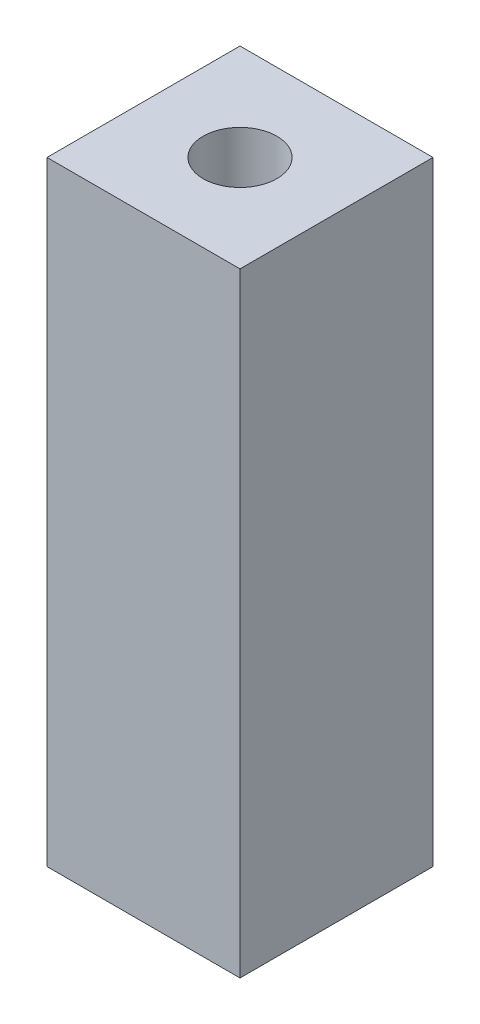
from build123d import *

# Parameters (mm, degrees)
SKETCH1_W             = 11
SKETCH1_H             = 11
BOSS_EXTRUDE1_DEPTH   = 35
M5X0_8_TAPPED_HOLE1_D = 4.2


with BuildPart() as part:
    # Sketch1 → Boss-Extrude1 (new body)
    with BuildSketch(Plane(origin=(0, 0, 0), x_dir=(1, 0, 0), z_dir=(0, 1, 0))):
        Rectangle(SKETCH1_W, SKETCH1_H)
    extrude(amount=BOSS_EXTRUDE1_DEPTH)

    # M5x0.8 Tapped Hole1 (through all)
    with Locations(Plane(origin=(0, 35, 0), x_dir=(1, 0, 0), z_dir=(0, 1, 0))):
        with Locations((0, 0)):
            Hole(M5X0_8_TAPPED_HOLE1_D / 2)


solid = part.part
